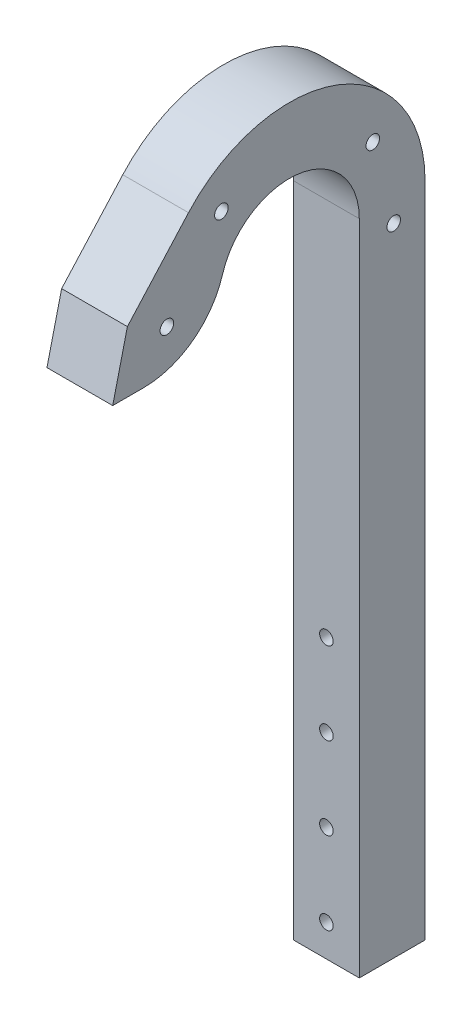
from build123d import *

# Parameters (mm, degrees)
BOSS_EXTRUDE1_DEPTH        = 20.32
F_8_0_199_DIAMETER_HOLE1_D = 4.191
CUT_EXTRUDE1_DEPTH         = 262.594137913
CUT_EXTRUDE1_DEPTH_BACK    = 262.594137913
SKETCH4_R                  = 2.0955


with BuildPart() as part:
    # Sketch1 → Boss-Extrude1 (new body)
    with BuildSketch(Plane(origin=(0, 0, 0), x_dir=(0, 0, -1), z_dir=(1, 0, 0))):
        with BuildLine():
            Line((-96.165603327, -175.75792688), (-116.485603327, -175.75792688))
            Line((-116.485603327, -175.75792688), (-116.485603327, 27.44207312))
            ThreePointArc((-116.485603327, 27.44207312), (-134.944175413, 48.803773877), (-158.757234566, 33.6387036))
            ThreePointArc((-158.757234566, 33.6387036), (-167.922977729, 20.553260194), (-183.088565435, 15.528857106))
            Line((-183.088565435, 15.528857106), (-192.685603327, 15.528857106))
            Line((-192.685603327, 15.528857106), (-188.14698461, 34.403768669))
            Line((-188.14698461, 34.403768669), (-169.26182214, 55.43971331))
            ThreePointArc((-169.26182214, 55.43971331), (-123.085045139, 66.579411625), (-96.165603327, 27.44207312))
            Line((-96.165603327, 27.44207312), (-96.165603327, -175.75792688))
        make_face()
    extrude(amount=BOSS_EXTRUDE1_DEPTH)

    # #8 (0.199) Diameter Hole1 (through all)
    with Locations(Plane.XY.offset(116.485603327)):
        with Locations((10.16, -89.697235998), (10.16, -115.097235998), (10.16, -140.497235998), (10.16, -165.897235998), (10.16, -191.297235998)):
            Hole(F_8_0_199_DIAMETER_HOLE1_D / 2)

    # Sketch4 → Cut-Extrude1 (cut, two sides: drawn at the far end of the back side and taken through both)
    with BuildSketch(Plane(origin=(20.32, 0, 0), x_dir=(0, 0, -1), z_dir=(1, 0, 0)).offset(-CUT_EXTRUDE1_DEPTH_BACK)):
        with Locations((-175.949281774, 28.226562255)):
            Circle(SKETCH4_R)
        with Locations((-159.099223615, 50.683912634)):
            Circle(SKETCH4_R)
        with Locations((-112.3119526, 45.871678806)):
            Circle(SKETCH4_R)
        with Locations((-105.851443143, 20.865071419)):
            Circle(SKETCH4_R)
    extrude(amount=CUT_EXTRUDE1_DEPTH + CUT_EXTRUDE1_DEPTH_BACK, mode=Mode.SUBTRACT)


solid = part.part
